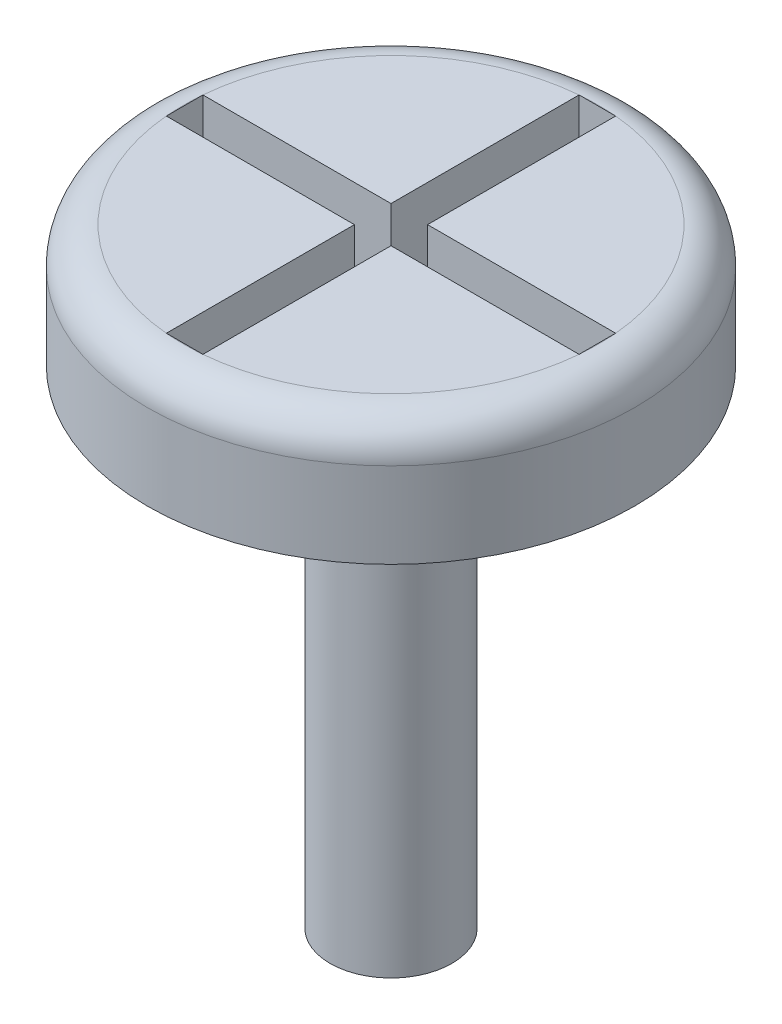
from build123d import *

# Parameters (mm, degrees)
SKETCH1_R           = 0.5
BOSS_EXTRUDE1_DEPTH = 5
SKETCH2_R           = 2
BOSS_EXTRUDE2_DEPTH = 1
FILLET1_R           = 0.3
CUT_EXTRUDE2_DEPTH  = 0.6


with BuildPart() as part:
    # Sketch1 → Boss-Extrude1 (new body)
    with BuildSketch(Plane(origin=(0, 0, 0), x_dir=(1, 0, 0), z_dir=(0, 1, 0))):
        with Locations(Location((0, 0, 0), (0, 0, 270))):
            Circle(SKETCH1_R)
    extrude(amount=BOSS_EXTRUDE1_DEPTH)

    # Sketch2 → Boss-Extrude2 (add)
    with BuildSketch(Plane(origin=(0, 5, 0), x_dir=(1, 0, 0), z_dir=(0, 1, 0))):
        with Locations(Location((0, 0, 0), (0, 0, 270))):
            Circle(SKETCH2_R)
    extrude(amount=-BOSS_EXTRUDE2_DEPTH)

    # Fillet1
    fillet1_edges = [part.edges().sort_by_distance(p)[0] for p in [
        (0, 5, -2),
    ]]
    fillet(fillet1_edges, radius=FILLET1_R)

    # Sketch3 → Cut-Extrude2 (cut)
    with BuildSketch(Plane(origin=(0, 5, 0), x_dir=(1, 0, 0), z_dir=(0, 1, 0))):
        Polygon((-0.15, 0.15), (-0.15, 1.693369422), (0.15, 1.693369422), (0.15, 0.15), (1.693369422, 0.15), (1.693369422, -0.15), (0.15, -0.15), (0.15, -1.693369422), (-0.15, -1.693369422), (-0.15, -0.15), (-1.693369422, -0.15), (-1.693369422, 0.15), align=None)
    extrude(amount=-CUT_EXTRUDE2_DEPTH, mode=Mode.SUBTRACT)


solid = part.part
